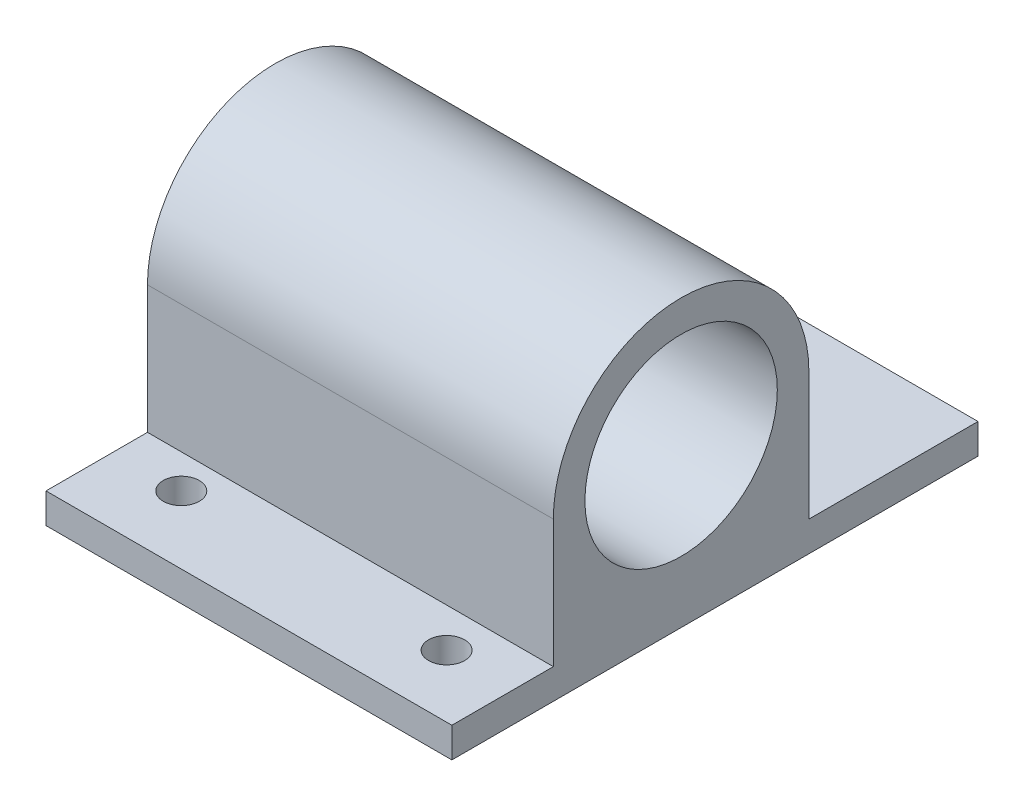
from build123d import *

# Parameters (mm, degrees)
SKETCH1_W            = 27
SKETCH1_H            = 35
SKETCH1_R            = 1.113712744
SKETCH1_R_2          = 1.000106258
SKETCH1_R_3          = 1.174626552
SKETCH1_R_4          = 1.19920455
SKETCH1_W_2          = 8.3
SKETCH1_H_2          = 2.12
BOSS_EXTRUDE1_DEPTH  = 2
M2_CLEARANCE_HOLE2_D = 2.4
SKETCH13_W           = 27
SKETCH13_H           = 17
BOSS_EXTRUDE6_DEPTH  = 17
SKETCH14_R           = 6.4
CUT_EXTRUDE3_DEPTH   = 38.815687555


with BuildPart() as part:
    # Sketch1 → Boss-Extrude1 (new body)
    # profile 1 of 8: a face of its own
    with BuildSketch(Plane(origin=(0, 0, 0), x_dir=(1, 0, 0), z_dir=(0, 1, 0))):
        with Locations((0.988085162, -0.939800033)):
            Rectangle(SKETCH1_W, SKETCH1_H)
        Polygon((-10.011914838, -15.939800033), (-10.011914838, 14.060199967), (11.988085162, 14.060199967), (11.988085162, -15.939800033), (5.138085162, -15.939800033), (5.138085162, -18.059800033), (-3.161914838, -18.059800033), (-3.161914838, -15.939800033), align=None, mode=Mode.SUBTRACT)
    # profile 2 of 8: a face of its own
    with BuildSketch(Plane(origin=(0, 0, 0), x_dir=(1, 0, 0), z_dir=(0, 1, 0))):
        Polygon((11.988085162, 14.060199967), (-10.011914838, 14.060199967), (-10.011914838, -15.939800033), (-3.161914838, -15.939800033), (-3.161914838, -13.819800033), (5.138085162, -13.819800033), (5.138085162, -15.939800033), (11.988085162, -15.939800033), align=None)
        with Locations((-8.011914838, -13.939800033)):
            Circle(SKETCH1_R, mode=Mode.SUBTRACT)
        with Locations((9.988085162, -14.291814947)):
            Circle(SKETCH1_R_2, mode=Mode.SUBTRACT)
        with Locations((-8.011914838, 7.560199967)):
            Circle(SKETCH1_R_3, mode=Mode.SUBTRACT)
        with Locations((9.988085162, 7.560199967)):
            Circle(SKETCH1_R_4, mode=Mode.SUBTRACT)
    # profile 3 of 8: a face of its own
    with BuildSketch(Plane(origin=(0, 0, 0), x_dir=(1, 0, 0), z_dir=(0, 1, 0))):
        with Locations((-8.011914838, 7.560199967)):
            Circle(SKETCH1_R_3)
    # profile 4 of 8: a face of its own
    with BuildSketch(Plane(origin=(0, 0, 0), x_dir=(1, 0, 0), z_dir=(0, 1, 0))):
        with Locations((9.988085162, 7.560199967)):
            Circle(SKETCH1_R_4)
    # profile 5 of 8: a face of its own
    with BuildSketch(Plane(origin=(0, 0, 0), x_dir=(1, 0, 0), z_dir=(0, 1, 0))):
        with Locations((9.988085162, -14.291814947)):
            Circle(SKETCH1_R_2)
    # profile 6 of 8: a face of its own
    with BuildSketch(Plane(origin=(0, 0, 0), x_dir=(1, 0, 0), z_dir=(0, 1, 0))):
        with Locations((0.988085162, -16.999800033)):
            Rectangle(SKETCH1_W_2, SKETCH1_H_2)
    # profile 7 of 8: a face of its own
    with BuildSketch(Plane(origin=(0, 0, 0), x_dir=(1, 0, 0), z_dir=(0, 1, 0))):
        with Locations((0.988085162, -14.879800033)):
            Rectangle(SKETCH1_W_2, SKETCH1_H_2)
    # profile 8 of 8: a face of its own
    with BuildSketch(Plane(origin=(0, 0, 0), x_dir=(1, 0, 0), z_dir=(0, 1, 0))):
        with Locations((-8.011914838, -13.939800033)):
            Circle(SKETCH1_R)
    extrude(amount=BOSS_EXTRUDE1_DEPTH)

    # M2 Clearance Hole2 (through all)
    with Locations(Plane(origin=(0, 2, 0), x_dir=(1, 0, 0), z_dir=(0, 1, 0))):
        with Locations((-8.011914838, 7.560199967), (9.988085162, 7.560199967), (-8.011914838, -13.939800033), (9.988085162, -14.291814947)):
            Hole(M2_CLEARANCE_HOLE2_D / 2)

    # Sketch13 → Boss-Extrude6 (add)
    with BuildSketch(Plane(origin=(0, 2, 0), x_dir=(1, 0, 0), z_dir=(0, 1, 0))):
        with Locations((0.988085162, -3.189800033)):
            Rectangle(SKETCH13_W, SKETCH13_H)
    extrude(amount=BOSS_EXTRUDE6_DEPTH)

    # Sketch14 → Cut-Extrude3 (cut, through all)
    with BuildSketch(Plane(origin=(14.488085162, 0, 0), x_dir=(0, 0, -1), z_dir=(1, 0, 0))):
        with Locations((-3.189800033, 10.5)):
            Circle(SKETCH14_R)
        with BuildLine():
            Line((5.310199967, 19), (-3.189800009, 19))
            ThreePointArc((-3.189800009, 19), (2.820607616, 16.510407631), (5.310199967, 10.5))
            Line((5.310199967, 10.5), (5.310199967, 19))
        make_face()
        with BuildLine():
            Line((-3.189800009, 19), (-11.689800033, 19))
            Line((-11.689800033, 19), (-11.689800033, 10.50000002))
            ThreePointArc((-11.689800033, 10.50000002), (-9.200207658, 16.510407656), (-3.189800009, 19))
        make_face()
    extrude(amount=-CUT_EXTRUDE3_DEPTH, mode=Mode.SUBTRACT)


solid = part.part
